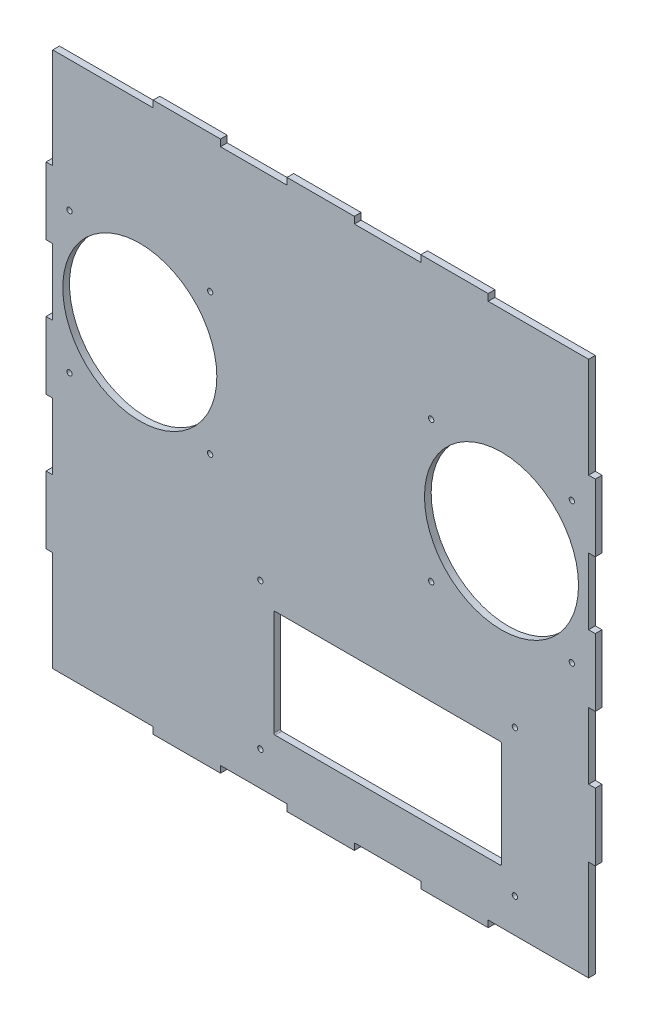
from build123d import *

# Parameters (mm, degrees)
SKIZZE1_W                       = 410
SKIZZE1_H                       = 410
AUFSATZ_LINEAR_AUSTRAGEN1_DEPTH = 5
SKIZZE2_W                       = 97.796702903
SKIZZE2_H                       = 49.6
SCHNITT_LINEAR_AUSTRAGEN1_DEPTH = 5
LINEARES_MUSTER1_COUNT          = 4
LINEARES_MUSTER1_PITCH          = 99.9
SPIEGELN1_COPY_1_SKETCH_W       = 97.796702903
SPIEGELN1_COPY_1_SKETCH_H       = 49.6
SPIEGELN1_COPY_1_DEPTH          = 5
SPIEGELN1_COPY_2_SKETCH_W       = 97.796702903
SPIEGELN1_COPY_2_SKETCH_H       = 49.6
SPIEGELN1_COPY_2_DEPTH          = 5
SPIEGELN1_COPY_3_SKETCH_W       = 97.796702903
SPIEGELN1_COPY_3_SKETCH_H       = 49.6
SPIEGELN1_COPY_3_DEPTH          = 5
SKIZZE3_W                       = 49.6
SKIZZE3_H                       = 41.77912255
SCHNITT_LINEAR_AUSTRAGEN2_DEPTH = 5
LINEARES_MUSTER2_COUNT          = 4
LINEARES_MUSTER2_PITCH          = 99.9
SPIEGELN2_COPY_1_SKETCH_W       = 49.6
SPIEGELN2_COPY_1_SKETCH_H       = 41.77912255
SPIEGELN2_COPY_1_DEPTH          = 5
SPIEGELN2_COPY_2_SKETCH_W       = 49.6
SPIEGELN2_COPY_2_SKETCH_H       = 41.77912255
SPIEGELN2_COPY_2_DEPTH          = 5
SPIEGELN2_COPY_3_SKETCH_W       = 49.6
SPIEGELN2_COPY_3_SKETCH_H       = 41.77912255
SPIEGELN2_COPY_3_DEPTH          = 5
SCHNITT_LINEAR_AUSTRAGEN3_DEPTH = 5
SPIEGELN4_COPY_1_DEPTH          = 5
SCHNITT_LINEAR_AUSTRAGEN4_REACH = 581.849
SKIZZE5_R                       = 57.5
SKIZZE5_R_2                     = 2
SKIZZE5_3_R                     = 2
SCHNITT_LINEAR_AUSTRAGEN5_DEPTH = 10


with BuildPart() as part:
    # Skizze1 → Aufsatz-Linear austragen1 (new body)
    with BuildSketch(Plane.XY):
        with Locations((205, 205)):
            Rectangle(SKIZZE1_W, SKIZZE1_H)
    extrude(amount=AUFSATZ_LINEAR_AUSTRAGEN1_DEPTH)

    # Skizze2 → Schnitt-Linear austragen1 (cut)
    with BuildSketch(Plane.XY.offset(5)):
        with Locations((-43.898351452, 354.85)):
            Rectangle(SKIZZE2_W, SKIZZE2_H)
    schnitt_linear_austragen1 = extrude(amount=-SCHNITT_LINEAR_AUSTRAGEN1_DEPTH, mode=Mode.SUBTRACT)

    # Lineares Muster1: Schnitt-Linear austragen1 ×4
    with Locations(*[(0, -i * LINEARES_MUSTER1_PITCH, 0) for i in range(1, LINEARES_MUSTER1_COUNT)]):
        add(schnitt_linear_austragen1, mode=Mode.SUBTRACT)

    # Spiegeln1: Schnitt-Linear austragen1 across plane
    add(schnitt_linear_austragen1.mirror(Plane(origin=(205, 0, 0), x_dir=(0, 0, 1), z_dir=(1, 0, 0))), mode=Mode.SUBTRACT)

    # Spiegeln1 copy 1 sketch → Spiegeln1 copy 1 (cut)
    with BuildSketch(Plane(origin=(410, -99.9, 5), x_dir=(-1, 0, 0), z_dir=(0, 0, 1))):
        with Locations((-43.898351452, -354.85)):
            Rectangle(SPIEGELN1_COPY_1_SKETCH_W, SPIEGELN1_COPY_1_SKETCH_H)
    extrude(amount=-SPIEGELN1_COPY_1_DEPTH, mode=Mode.SUBTRACT)

    # Spiegeln1 copy 2 sketch → Spiegeln1 copy 2 (cut)
    with BuildSketch(Plane(origin=(410, -199.8, 5), x_dir=(-1, 0, 0), z_dir=(0, 0, 1))):
        with Locations((-43.898351452, -354.85)):
            Rectangle(SPIEGELN1_COPY_2_SKETCH_W, SPIEGELN1_COPY_2_SKETCH_H)
    extrude(amount=-SPIEGELN1_COPY_2_DEPTH, mode=Mode.SUBTRACT)

    # Spiegeln1 copy 3 sketch → Spiegeln1 copy 3 (cut)
    with BuildSketch(Plane(origin=(410, -299.7, 5), x_dir=(-1, 0, 0), z_dir=(0, 0, 1))):
        with Locations((-43.898351452, -354.85)):
            Rectangle(SPIEGELN1_COPY_3_SKETCH_W, SPIEGELN1_COPY_3_SKETCH_H)
    extrude(amount=-SPIEGELN1_COPY_3_DEPTH, mode=Mode.SUBTRACT)

    # Skizze3 → Schnitt-Linear austragen2 (cut)
    with BuildSketch(Plane.XY.offset(5)):
        with Locations((55.15, 425.889561275)):
            Rectangle(SKIZZE3_W, SKIZZE3_H)
    schnitt_linear_austragen2 = extrude(amount=-SCHNITT_LINEAR_AUSTRAGEN2_DEPTH, mode=Mode.SUBTRACT)

    # Lineares Muster2: Schnitt-Linear austragen2 ×4
    with Locations(*[(i * LINEARES_MUSTER2_PITCH, 0, 0) for i in range(1, LINEARES_MUSTER2_COUNT)]):
        add(schnitt_linear_austragen2, mode=Mode.SUBTRACT)

    # Spiegeln2: Schnitt-Linear austragen2 across plane
    add(schnitt_linear_austragen2.mirror(Plane.ZX.offset(205)), mode=Mode.SUBTRACT)

    # Spiegeln2 copy 1 sketch → Spiegeln2 copy 1 (cut)
    with BuildSketch(Plane(origin=(99.9, 410, 5), x_dir=(1, 0, 0), z_dir=(0, 0, 1))):
        with Locations((55.15, -425.889561275)):
            Rectangle(SPIEGELN2_COPY_1_SKETCH_W, SPIEGELN2_COPY_1_SKETCH_H)
    extrude(amount=-SPIEGELN2_COPY_1_DEPTH, mode=Mode.SUBTRACT)

    # Spiegeln2 copy 2 sketch → Spiegeln2 copy 2 (cut)
    with BuildSketch(Plane(origin=(199.8, 410, 5), x_dir=(1, 0, 0), z_dir=(0, 0, 1))):
        with Locations((55.15, -425.889561275)):
            Rectangle(SPIEGELN2_COPY_2_SKETCH_W, SPIEGELN2_COPY_2_SKETCH_H)
    extrude(amount=-SPIEGELN2_COPY_2_DEPTH, mode=Mode.SUBTRACT)

    # Spiegeln2 copy 3 sketch → Spiegeln2 copy 3 (cut)
    with BuildSketch(Plane(origin=(299.7, 410, 5), x_dir=(1, 0, 0), z_dir=(0, 0, 1))):
        with Locations((55.15, -425.889561275)):
            Rectangle(SPIEGELN2_COPY_3_SKETCH_W, SPIEGELN2_COPY_3_SKETCH_H)
    extrude(amount=-SPIEGELN2_COPY_3_DEPTH, mode=Mode.SUBTRACT)

    # Skizze4 → Schnitt-Linear austragen3 (cut)
    with BuildSketch(Plane.XY.offset(5)):
        Polygon((5, 379.65), (5, 405), (30.35, 405), (30.35, 431.549801047), (5, 431.549801047), (-47.862925009, 431.549801047), (-47.862925009, 405), (-47.862925009, 379.65), align=None)
    schnitt_linear_austragen3 = extrude(amount=-SCHNITT_LINEAR_AUSTRAGEN3_DEPTH, mode=Mode.SUBTRACT)

    # Spiegeln3: Schnitt-Linear austragen3 across plane
    add(schnitt_linear_austragen3.mirror(Plane(origin=(205, 0, 0), x_dir=(0, 0, 1), z_dir=(1, 0, 0))), mode=Mode.SUBTRACT)

    # Spiegeln4: Schnitt-Linear austragen3 across plane
    add(schnitt_linear_austragen3.mirror(Plane.ZX.offset(205)), mode=Mode.SUBTRACT)

    # Spiegeln4 copy 1 sketch → Spiegeln4 copy 1 (cut)
    with BuildSketch(Plane(origin=(410, 410, 5), x_dir=(-1, 0, 0), z_dir=(0, 0, 1))):
        Polygon((5, 379.65), (5, 405), (30.35, 405), (30.35, 431.549801047), (5, 431.549801047), (-47.862925009, 431.549801047), (-47.862925009, 405), (-47.862925009, 379.65), align=None)
    extrude(amount=-SPIEGELN4_COPY_1_DEPTH, mode=Mode.SUBTRACT)

    # Skizze5 → Schnitt-Linear austragen4 (cut, up to next)
    with BuildSketch(Plane(origin=(0, 0, 0), x_dir=(-1, 0, 0), z_dir=(0, 0, -1)), mode=Mode.PRIVATE) as schnitt_linear_austragen4_sk1:
        with Locations((-340, 255)):
            Circle(SKIZZE5_R)
    schnitt_linear_austragen4_tool1 = extrude(schnitt_linear_austragen4_sk1.sketch, amount=-SCHNITT_LINEAR_AUSTRAGEN4_REACH, mode=Mode.PRIVATE) & part.part
    # Skizze5 → Schnitt-Linear austragen4 (cut, up to next)
    with BuildSketch(Plane(origin=(0, 0, 0), x_dir=(-1, 0, 0), z_dir=(0, 0, -1)), mode=Mode.PRIVATE) as schnitt_linear_austragen4_sk2:
        with Locations((-287.5, 307.5)):
            Circle(SKIZZE5_R_2)
    schnitt_linear_austragen4_tool2 = extrude(schnitt_linear_austragen4_sk2.sketch, amount=-SCHNITT_LINEAR_AUSTRAGEN4_REACH, mode=Mode.PRIVATE) & part.part
    # Skizze5 → Schnitt-Linear austragen4 (cut, up to next)
    with BuildSketch(Plane(origin=(0, 0, 0), x_dir=(-1, 0, 0), z_dir=(0, 0, -1)), mode=Mode.PRIVATE) as schnitt_linear_austragen4_sk3:
        with Locations((-392.5, 202.5)):
            Circle(SKIZZE5_R_2)
    schnitt_linear_austragen4_tool3 = extrude(schnitt_linear_austragen4_sk3.sketch, amount=-SCHNITT_LINEAR_AUSTRAGEN4_REACH, mode=Mode.PRIVATE) & part.part
    # Skizze5 → Schnitt-Linear austragen4 (cut, up to next)
    with BuildSketch(Plane(origin=(0, 0, 0), x_dir=(-1, 0, 0), z_dir=(0, 0, -1)), mode=Mode.PRIVATE) as schnitt_linear_austragen4_sk4:
        with Locations((-392.5, 307.5)):
            Circle(SKIZZE5_R_2)
    schnitt_linear_austragen4_tool4 = extrude(schnitt_linear_austragen4_sk4.sketch, amount=-SCHNITT_LINEAR_AUSTRAGEN4_REACH, mode=Mode.PRIVATE) & part.part
    # Skizze5 → Schnitt-Linear austragen4 (cut, up to next)
    with BuildSketch(Plane(origin=(0, 0, 0), x_dir=(-1, 0, 0), z_dir=(0, 0, -1)), mode=Mode.PRIVATE) as schnitt_linear_austragen4_sk5:
        with Locations((-287.5, 202.5)):
            Circle(SKIZZE5_R_2)
    schnitt_linear_austragen4_tool5 = extrude(schnitt_linear_austragen4_sk5.sketch, amount=-SCHNITT_LINEAR_AUSTRAGEN4_REACH, mode=Mode.PRIVATE) & part.part
    schnitt_linear_austragen4_1 = schnitt_linear_austragen4_tool1.solids().sort_by_distance((340, 255, 0))[0]
    add(schnitt_linear_austragen4_1, mode=Mode.SUBTRACT)
    schnitt_linear_austragen4_2 = schnitt_linear_austragen4_tool2.solids().sort_by_distance((287.5, 307.5, 0))[0]
    add(schnitt_linear_austragen4_2, mode=Mode.SUBTRACT)
    schnitt_linear_austragen4_3 = schnitt_linear_austragen4_tool3.solids().sort_by_distance((392.5, 202.5, 0))[0]
    add(schnitt_linear_austragen4_3, mode=Mode.SUBTRACT)
    schnitt_linear_austragen4_4 = schnitt_linear_austragen4_tool4.solids().sort_by_distance((392.5, 307.5, 0))[0]
    add(schnitt_linear_austragen4_4, mode=Mode.SUBTRACT)
    schnitt_linear_austragen4_5 = schnitt_linear_austragen4_tool5.solids().sort_by_distance((287.5, 202.5, 0))[0]
    add(schnitt_linear_austragen4_5, mode=Mode.SUBTRACT)
    schnitt_linear_austragen4 = schnitt_linear_austragen4_1 + schnitt_linear_austragen4_2 + schnitt_linear_austragen4_3 + schnitt_linear_austragen4_4 + schnitt_linear_austragen4_5  # Schnitt-Linear austragen4 as one shape, for the pattern or mirror that repeats it

    # Skizze5<3> → Schnitt-Linear austragen5 (cut)
    with BuildSketch(Plane(origin=(0, 0, 0), x_dir=(-1, 0, 0), z_dir=(0, 0, -1))):
        with Locations((-350, 139.5)):
            Circle(SKIZZE5_3_R)
        with Locations((-160, 139.5)):
            Circle(SKIZZE5_3_R)
        with Locations((-160, 30.5)):
            Circle(SKIZZE5_3_R)
        with Locations((-350, 30.5)):
            Circle(SKIZZE5_3_R)
        with BuildLine():
            Line((-339, 125), (-171, 125))
            ThreePointArc((-171, 125), (-170.292893219, 124.707106781), (-170, 124))
            Line((-170, 124), (-170, 46))
            ThreePointArc((-170, 46), (-170.292893219, 45.292893219), (-171, 45))
            Line((-171, 45), (-339, 45))
            ThreePointArc((-339, 45), (-339.707106781, 45.292893219), (-340, 46))
            Line((-340, 46), (-340, 124))
            ThreePointArc((-340, 124), (-339.707106781, 124.707106781), (-339, 125))
        make_face()
    extrude(amount=-SCHNITT_LINEAR_AUSTRAGEN5_DEPTH, mode=Mode.SUBTRACT)

    # Spiegeln5: Schnitt-Linear austragen4 across plane
    add(schnitt_linear_austragen4.mirror(Plane(origin=(205, 0, 0), x_dir=(0, 0, 1), z_dir=(1, 0, 0))), mode=Mode.SUBTRACT)


solid = part.part
